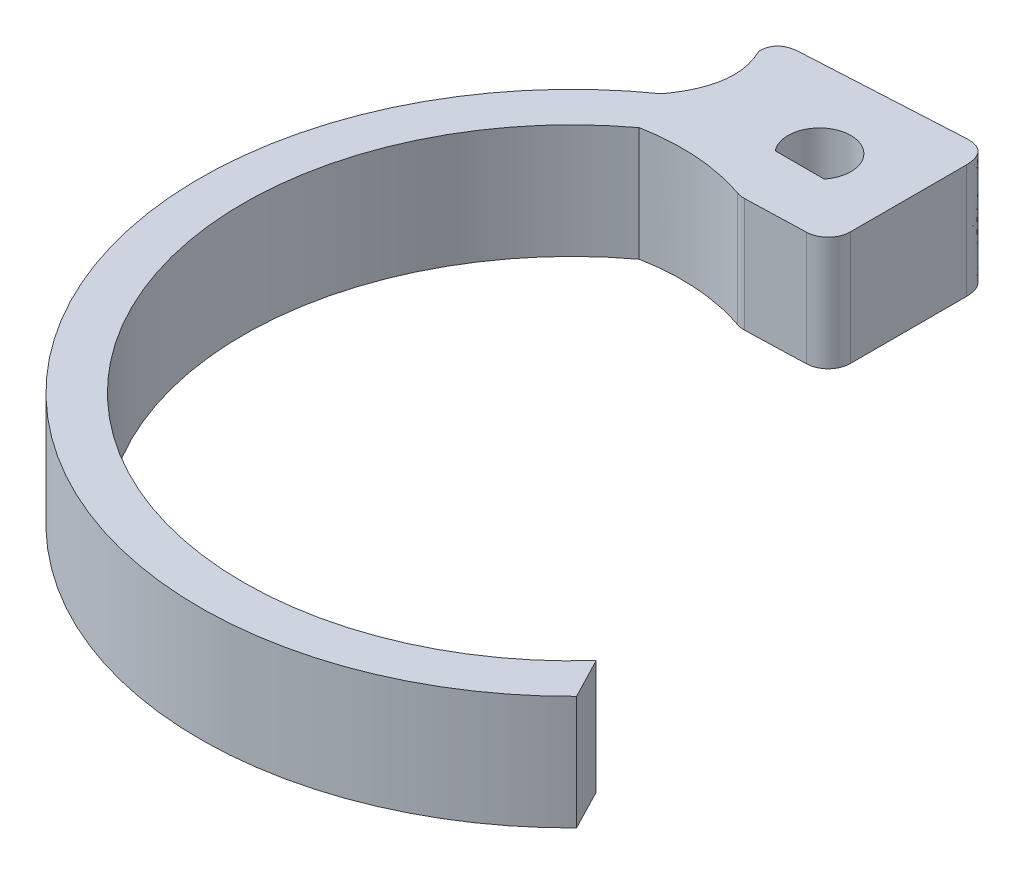
from build123d import *

# Parameters (mm, degrees)
BOSS_EXTRUDE2_DEPTH     = 6.35
CUT_EXTRUDE1_DEPTH      = 0.254
CUT_EXTRUDE1_DEPTH_BACK = 13.208


with BuildPart() as part:
    # Sketch3 → Boss-Extrude2 (new, symmetric)
    with BuildSketch(Plane(origin=(0, 0, 0), x_dir=(1, 0, 0), z_dir=(0, 1, 0))):
        with BuildLine():
            Line((-52.600480424, -4.148495284), (-35.004351305, -3.195671149))
            add(Edge.make_bspline(
                [(-35.004351305, -3.195671149), (-32.391383355, -3.02906189), (-32.327012412, -5.731955445)],
                knots=[0, 0, 0, 1, 1, 1], degree=2))
            Line((-32.327012412, -5.731955445), (-32.327012412, -18.663867238))
            ThreePointArc((-32.327012412, -18.663867238), (-33.026692388, -20.3892504), (-34.730486544, -21.139973114))
            Line((-34.730486544, -21.139973114), (-41.447053807, -21.339967417))
            ThreePointArc((-41.447053807, -21.339967417), (-41.905677943, -21.312046914), (-42.351768326, -21.201960476))
            add(Edge.make_bspline(
                [(-42.351768326, -21.201960476), (-46.143088768, -19.892664891), (-50.094878971, -19.611768994), (-54.151069137, -20.370220418)],
                knots=[0.036271326, 0.036271326, 0.036271326, 0.036271326, 1, 1, 1, 1], degree=3))
            ThreePointArc((-54.151069137, -20.370220418), (-59.359137989, -74.344180893), (-5.134779033, -74.167301495))
            Line((-5.134779033, -74.167301495), (-2.773203125, -78.720626621))
            ThreePointArc((-2.773203125, -78.720626621), (-63.885313617, -76.526016755), (-56.177196586, -15.862260746))
            add(Edge.make_bspline(
                [(-54.866343349, -6.308912993), (-52.55640985, -10.963519078), (-56.177196586, -15.862260746)],
                knots=[0, 0, 0, 1, 1, 1], degree=2))
            add(Edge.make_bspline(
                [(-54.866343349, -6.308912993), (-54.833497461, -4.293658489), (-52.600480424, -4.148495284)],
                knots=[0, 0, 0, 1, 1, 1], degree=2))
        make_face()
    extrude(amount=BOSS_EXTRUDE2_DEPTH, both=True)

    # Sketch11 → Cut-Extrude1 (cut, two sides: drawn at the far end of the back side and taken through both)
    with BuildSketch(Plane(origin=(0, -6.35, 0), x_dir=(-1, 0, 0), z_dir=(0, -1, 0)).offset(-CUT_EXTRUDE1_DEPTH_BACK)):
        with BuildLine():
            Line((38.879229539, -15.029066428), (44.328612102, -15.029066428))
            ThreePointArc((44.328612102, -15.029066428), (41.603920821, -9.332237481), (38.879229539, -15.029066428))
        make_face()
    extrude(amount=CUT_EXTRUDE1_DEPTH + CUT_EXTRUDE1_DEPTH_BACK, mode=Mode.SUBTRACT)


solid = part.part
